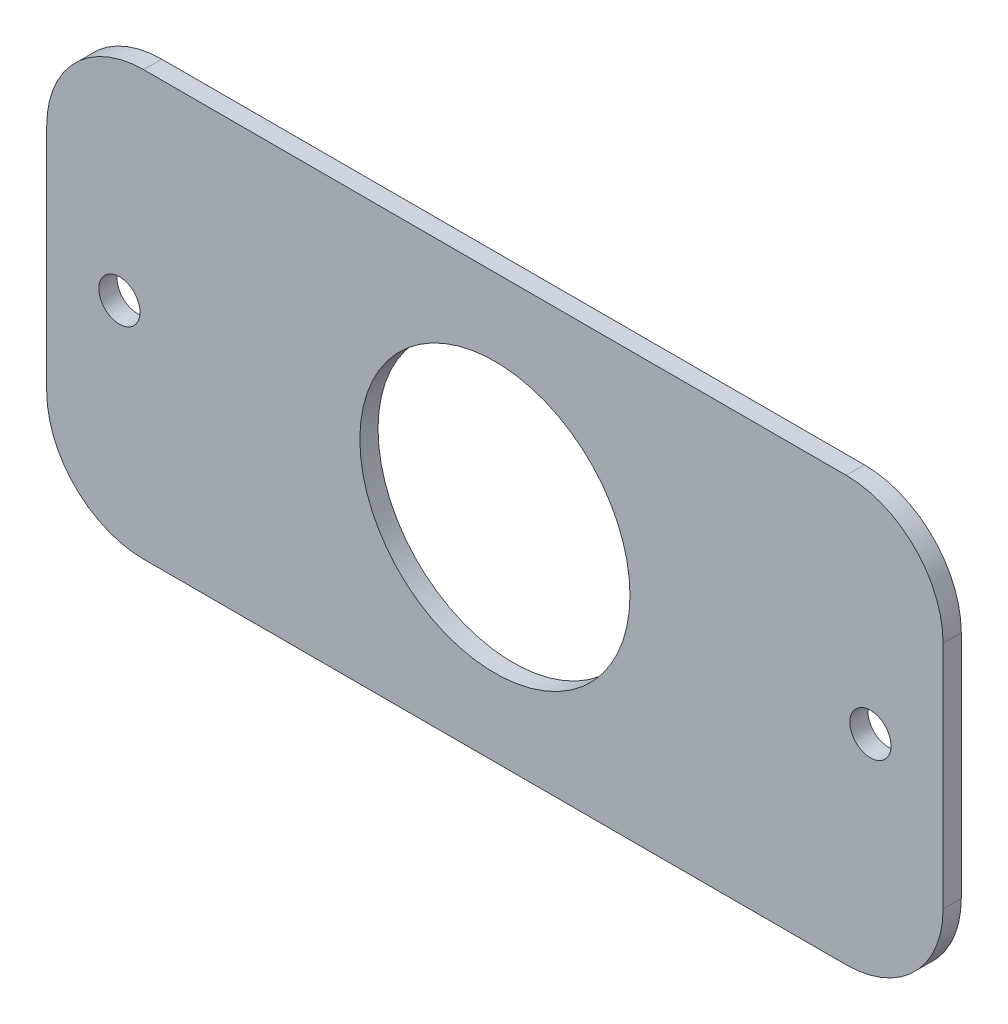
from build123d import *

# Parameters (mm, degrees)
ESQUISSE1_W          = 74
ESQUISSE1_H          = 35
ESQUISSE1_R          = 11.15
ESQUISSE1_R_2        = 1.5
BOSS_EXTRU_1_DEPTH   = 1.5
D_GAGEMENT_M31_D     = 3.4
D_GAGEMENT_M31_DEPTH = 1.5
CONG_1_R             = 8


with BuildPart() as part:
    # Esquisse1 → Boss.-Extru.1 (new body)
    with BuildSketch(Plane.XY):
        with Locations((37, 17.5)):
            Rectangle(ESQUISSE1_W, ESQUISSE1_H)
        with Locations((37, 17.5)):
            Circle(ESQUISSE1_R, mode=Mode.SUBTRACT)
        with Locations((6, 17.5)):
            Circle(ESQUISSE1_R_2, mode=Mode.SUBTRACT)
        with Locations((68, 17.5)):
            Circle(ESQUISSE1_R_2, mode=Mode.SUBTRACT)
    extrude(amount=BOSS_EXTRU_1_DEPTH)

    # Dégagement M31
    with Locations(Plane.XY.offset(1.5)):
        with Locations((6, 17.5), (68, 17.5)):
            Hole(D_GAGEMENT_M31_D / 2, depth=D_GAGEMENT_M31_DEPTH)

    # Congé1
    cong_1_edges = [part.edges().sort_by_distance(p)[0] for p in [
        (0, 35, 0.75),
        (74, 35, 0.75),
        (74, 0, 0.75),
        (0, 0, 0.75),
    ]]
    fillet(cong_1_edges, radius=CONG_1_R)


solid = part.part
